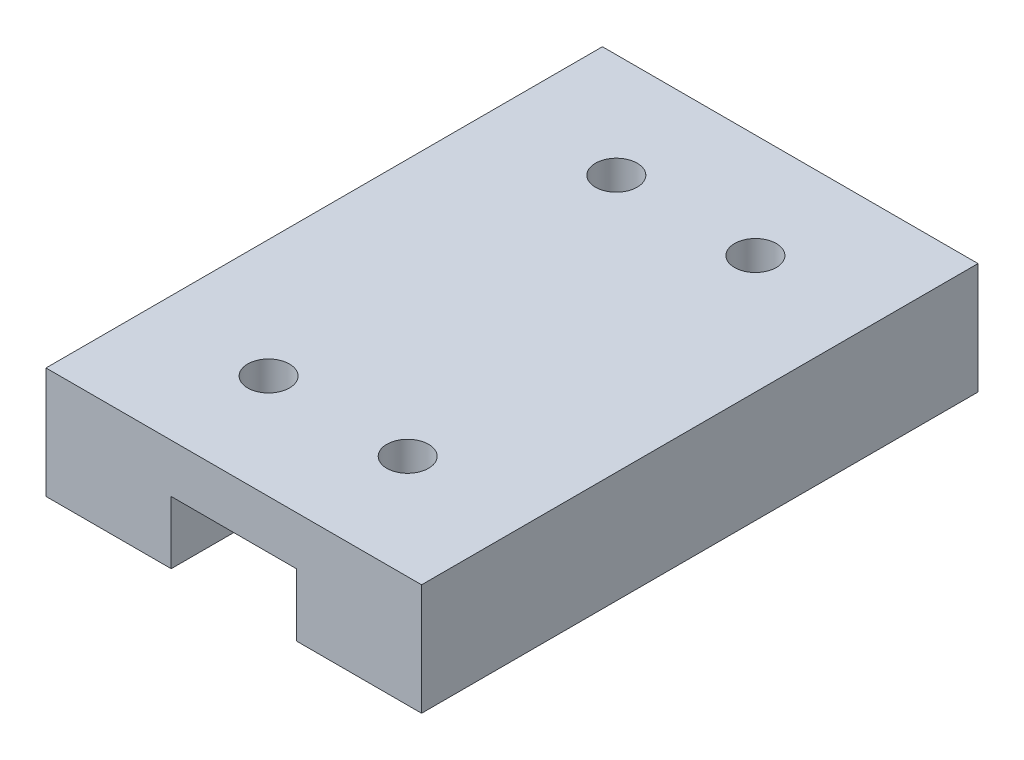
from build123d import *

# Parameters (mm, degrees)
EXTRUDE_1_DEPTH     = 20
SKETCH_2_R          = 1.5
CUT_EXTRUDE_1_DEPTH = 2.5


with BuildPart() as part:
    # 草图1 → 凸台-拉伸1 (new, symmetric)
    with BuildSketch(Plane.XY):
        Polygon((-4.5, 4.5), (4.5, 4.5), (4.5, 0), (13.5, 0), (13.5, 8), (-13.5, 8), (-13.5, 0), (-4.5, 0), align=None)
    extrude(amount=EXTRUDE_1_DEPTH, both=True)

    # 草图2 → 切除-拉伸1 (cut)
    with BuildSketch(Plane(origin=(0, 8, 0), x_dir=(1, 0, 0), z_dir=(0, 1, 0))):
        with Locations(Location((5, 12.5, 0), (0, 0, 180))):
            Circle(SKETCH_2_R)
        with Locations((-5, 12.5)):
            Circle(SKETCH_2_R)
        with Locations(Location((-5, -12.5, 0), (0, 0, 180))):
            Circle(SKETCH_2_R)
        with Locations((5, -12.5)):
            Circle(SKETCH_2_R)
    extrude(amount=-CUT_EXTRUDE_1_DEPTH, mode=Mode.SUBTRACT)


solid = part.part
